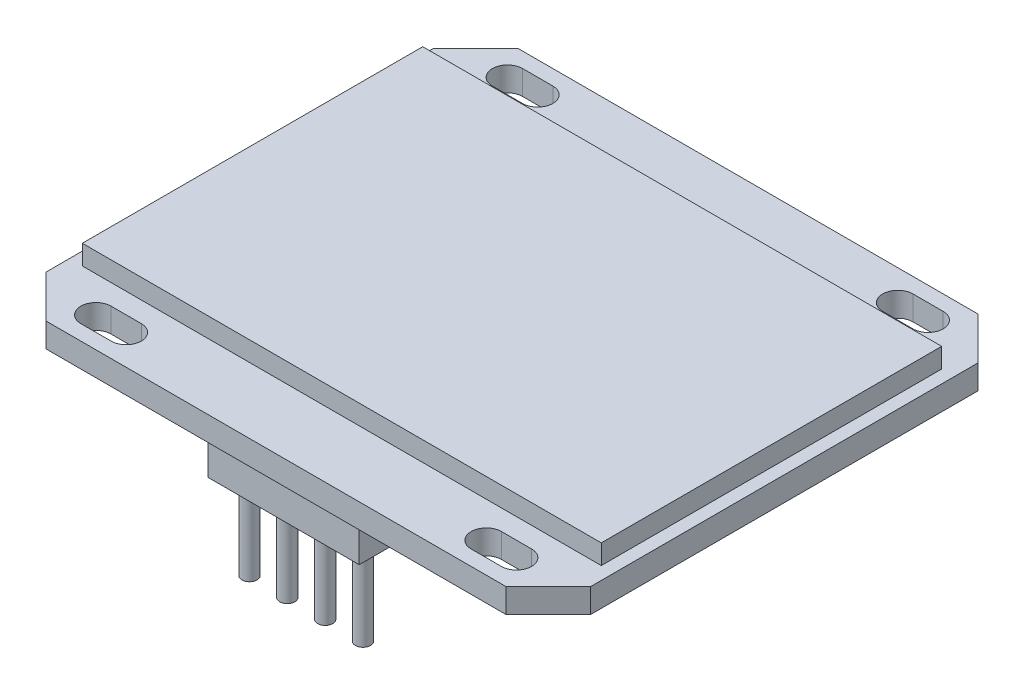
from build123d import *

# Parameters (mm, degrees)
SKETCH_1_W             = 36
SKETCH_1_H             = 31.2
EXTRUDE_1_DEPTH        = 1.6
SKETCH_2_W             = 34.3
SKETCH_2_H             = 22.5
EXTRUDE_2_DEPTH        = 1.3
CUT_EXTRUDE_1_DEPTH    = 24.872997298
CHAMFER_1_SIZE         = 2.8
SKETCH_4_W             = 10
SKETCH_4_H             = 2.5
EXTRUDE_3_DEPTH        = 2.5
SKETCH_5_R             = 0.5
EXTRUDE_4_DEPTH        = 5.5
PATTERN_LINEAR_1_COUNT = 4
PATTERN_LINEAR_1_PITCH = 2.5


with BuildPart() as part:
    # 草图1 → 凸台-拉伸1 (new body)
    with BuildSketch(Plane(origin=(0, 0, 0), x_dir=(1, 0, 0), z_dir=(0, 1, 0))):
        Rectangle(SKETCH_1_W, SKETCH_1_H)
    extrude(amount=EXTRUDE_1_DEPTH)

    # 草图2 → 凸台-拉伸2 (add)
    with BuildSketch(Plane(origin=(0, 1.6, 0), x_dir=(1, 0, 0), z_dir=(0, 1, 0))):
        Rectangle(SKETCH_2_W, SKETCH_2_H)
    extrude(amount=EXTRUDE_2_DEPTH)

    # 草图3 → 切除-拉伸1 (cut, through all)
    with BuildSketch(Plane(origin=(0, 1.6, 0), x_dir=(1, 0, 0), z_dir=(0, 1, 0))):
        with BuildLine():
            Line((-13.9, 14.6), (-11.9, 14.6))
            ThreePointArc((-11.9, 14.6), (-10.9, 13.6), (-11.9, 12.6))
            Line((-11.9, 12.6), (-13.9, 12.6))
            ThreePointArc((-13.9, 12.6), (-14.9, 13.6), (-13.9, 14.6))
        make_face()
        with BuildLine():
            Line((13.9, 14.6), (11.9, 14.6))
            ThreePointArc((11.9, 14.6), (10.9, 13.6), (11.9, 12.6))
            Line((11.9, 12.6), (13.9, 12.6))
            ThreePointArc((13.9, 12.6), (14.9, 13.6), (13.9, 14.6))
        make_face()
        with BuildLine():
            Line((13.9, -14.6), (11.9, -14.6))
            ThreePointArc((11.9, -14.6), (10.9, -13.6), (11.9, -12.6))
            Line((11.9, -12.6), (13.9, -12.6))
            ThreePointArc((13.9, -12.6), (14.9, -13.6), (13.9, -14.6))
        make_face()
        with BuildLine():
            Line((-13.9, -14.6), (-11.9, -14.6))
            ThreePointArc((-11.9, -14.6), (-10.9, -13.6), (-11.9, -12.6))
            Line((-11.9, -12.6), (-13.9, -12.6))
            ThreePointArc((-13.9, -12.6), (-14.9, -13.6), (-13.9, -14.6))
        make_face()
    extrude(amount=-CUT_EXTRUDE_1_DEPTH, mode=Mode.SUBTRACT)

    # 倒角1
    chamfer_1_edges = [part.edges().sort_by_distance(p)[0] for p in [
        (18, 0.8, 15.6),
        (-18, 0.8, 15.6),
        (-18, 0.8, -15.6),
        (18, 0.8, -15.6),
    ]]
    chamfer(chamfer_1_edges, length=CHAMFER_1_SIZE)

    # 草图4 → 凸台-拉伸3 (add)
    with BuildSketch(Plane.XZ):
        with Locations((0, 13.85)):
            Rectangle(SKETCH_4_W, SKETCH_4_H)
    extrude(amount=EXTRUDE_3_DEPTH)

    # 草图5 → 凸台-拉伸4 (add)
    with BuildSketch(Plane.XZ.offset(2.5)):
        with Locations(Location((-3.5, 13.85, 0), (0, 0, 90))):
            Circle(SKETCH_5_R)
    extrude_4 = extrude(amount=EXTRUDE_4_DEPTH)

    # 阵列(线性)1: 凸台-拉伸4 ×4
    with Locations(*[(i * PATTERN_LINEAR_1_PITCH, 0, 0) for i in range(1, PATTERN_LINEAR_1_COUNT)]):
        add(extrude_4)


solid = part.part
